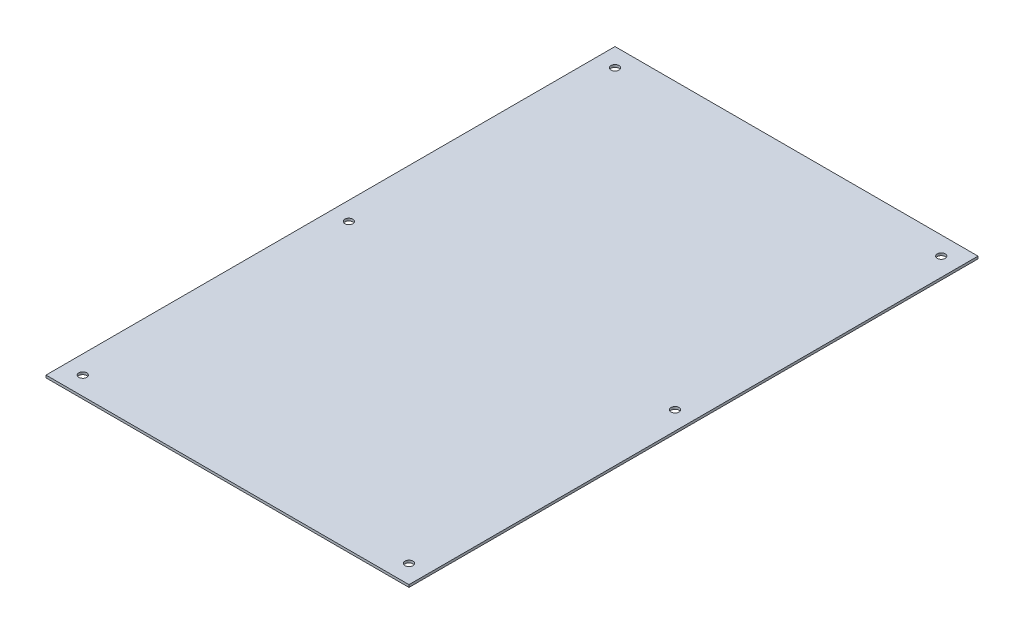
from build123d import *

# Parameters (mm, degrees)
SKETCH1_W           = 296
SKETCH1_H           = 464
BOSS_EXTRUDE1_DEPTH = 2
SKETCH2_R           = 3.25
CUT_EXTRUDE1_DEPTH  = 2


with BuildPart() as part:
    # Sketch1 → Boss-Extrude1 (new body)
    with BuildSketch(Plane(origin=(0, 0, 0), x_dir=(1, 0, 0), z_dir=(0, 1, 0))):
        Rectangle(SKETCH1_W, SKETCH1_H)
    extrude(amount=BOSS_EXTRUDE1_DEPTH)

    # Sketch2 → Cut-Extrude1 (cut)
    with BuildSketch(Plane(origin=(0, 2, 0), x_dir=(1, 0, 0), z_dir=(0, 1, 0))):
        with Locations(Location((-133, 217, 0), (0, 0, 270))):
            Circle(SKETCH2_R)
        with Locations(Location((133, 217, 0), (0, 0, 90))):
            Circle(SKETCH2_R)
        with Locations(Location((-133, -217, 0), (0, 0, 90))):
            Circle(SKETCH2_R)
        with Locations(Location((133, -217, 0), (0, 0, 270))):
            Circle(SKETCH2_R)
        with Locations(Location((133, 0, 0), (0, 0, 270))):
            Circle(SKETCH2_R)
        with Locations(Location((-133, 0, 0), (0, 0, 90))):
            Circle(SKETCH2_R)
    extrude(amount=-CUT_EXTRUDE1_DEPTH, mode=Mode.SUBTRACT)


solid = part.part
